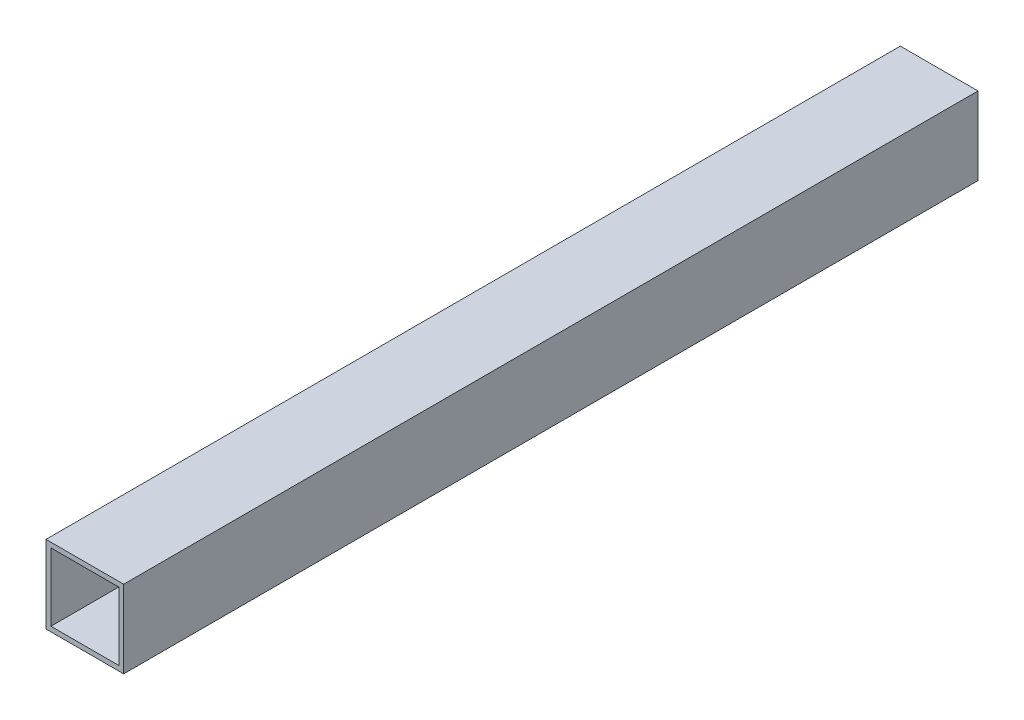
from build123d import *

# Parameters (mm, degrees)
SKETCH1_W           = 25.4
SKETCH1_H           = 25.4
SKETCH1_W_2         = 22.1996
SKETCH1_H_2         = 22.1996
BOSS_EXTRUDE1_DEPTH = 279.4


with BuildPart() as part:
    # Sketch1 → Boss-Extrude1 (new body)
    with BuildSketch(Plane.XY):
        Rectangle(SKETCH1_W, SKETCH1_H)
        Rectangle(SKETCH1_W_2, SKETCH1_H_2, mode=Mode.SUBTRACT)
    extrude(amount=BOSS_EXTRUDE1_DEPTH)


solid = part.part
